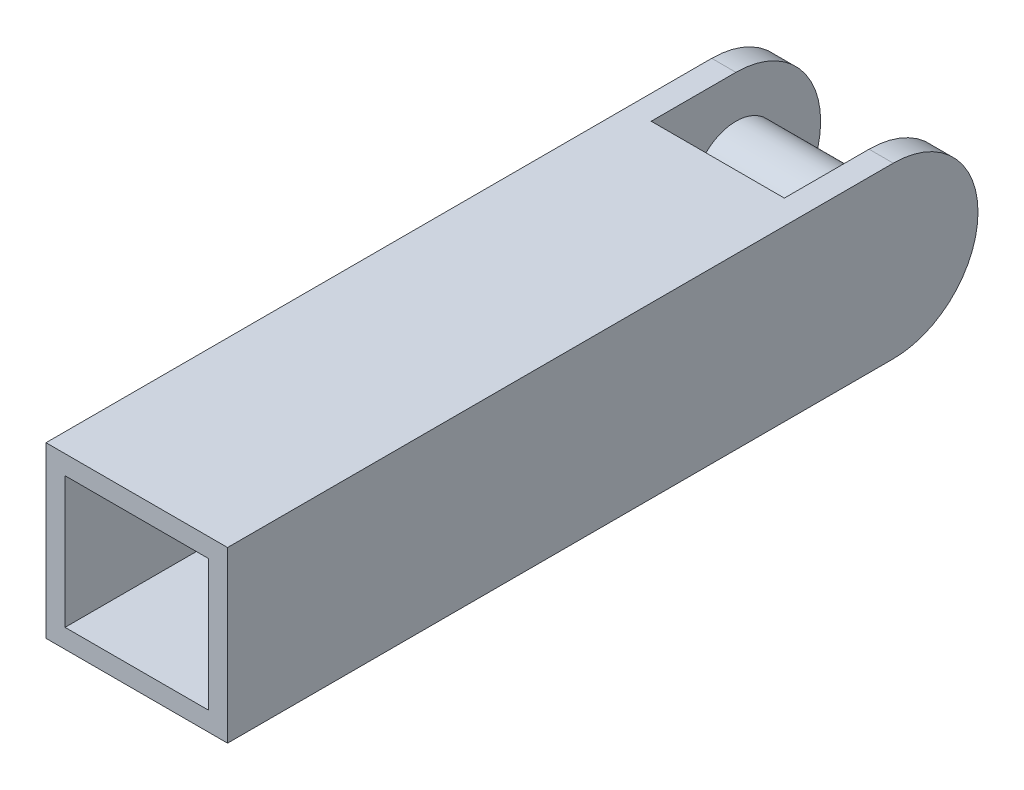
from build123d import *

# Parameters (mm, degrees)
SKETCH1_R           = 22.225
BOSS_EXTRUDE1_DEPTH = 34.925
BOSS_EXTRUDE2_START = -34.925
BOSS_EXTRUDE2_DEPTH = 12.7
SKETCH2_3_W         = 304.8
SKETCH2_3_H         = 88.9
BOSS_EXTRUDE3_DEPTH = 47.625
SKETCH3_W           = 75.25
SKETCH3_H           = 68.9
CUT_EXTRUDE1_DEPTH  = 149.86


with BuildPart() as part:
    # Sketch1 → Boss-Extrude1 (new, symmetric)
    with BuildSketch(Plane(origin=(0, 0, 0), x_dir=(0, 0, -1), z_dir=(1, 0, 0))):
        Circle(SKETCH1_R)
    extrude(amount=BOSS_EXTRUDE1_DEPTH, both=True)

    # Sketch2 → Boss-Extrude2 (add)
    with BuildSketch(Plane(origin=(0, 0, 0), x_dir=(0, 0, -1), z_dir=(1, 0, 0)).offset(BOSS_EXTRUDE2_START)):
        with BuildLine():
            Line((0, 44.45), (-44.45, 44.45))
            Line((-44.45, 44.45), (-44.45, -44.45))
            Line((-44.45, -44.45), (0, -44.45))
            ThreePointArc((0, -44.45), (44.45, 0), (0, 44.45))
        make_face()
    extrude(amount=-BOSS_EXTRUDE2_DEPTH)

    # Sketch2<3> → Boss-Extrude3 (add)
    with BuildSketch(Plane(origin=(0, 0, 0), x_dir=(0, 0, -1), z_dir=(1, 0, 0))):
        with Locations((-196.85, 0)):
            Rectangle(SKETCH2_3_W, SKETCH2_3_H)
    extrude(amount=-BOSS_EXTRUDE3_DEPTH)

    # Mirror6: part across plane


with BuildPart() as part_1:
    add(part.part)
    add(part.part.mirror(Plane(origin=(0, 0, 0), x_dir=(0, 0, 1), z_dir=(1, 0, 0))))

    # Sketch3 → Cut-Extrude1 (cut)
    with BuildSketch(Plane.XY.offset(349.25)):
        Rectangle(SKETCH3_W, SKETCH3_H)
    extrude(amount=-CUT_EXTRUDE1_DEPTH, mode=Mode.SUBTRACT)


solid = part_1.part
